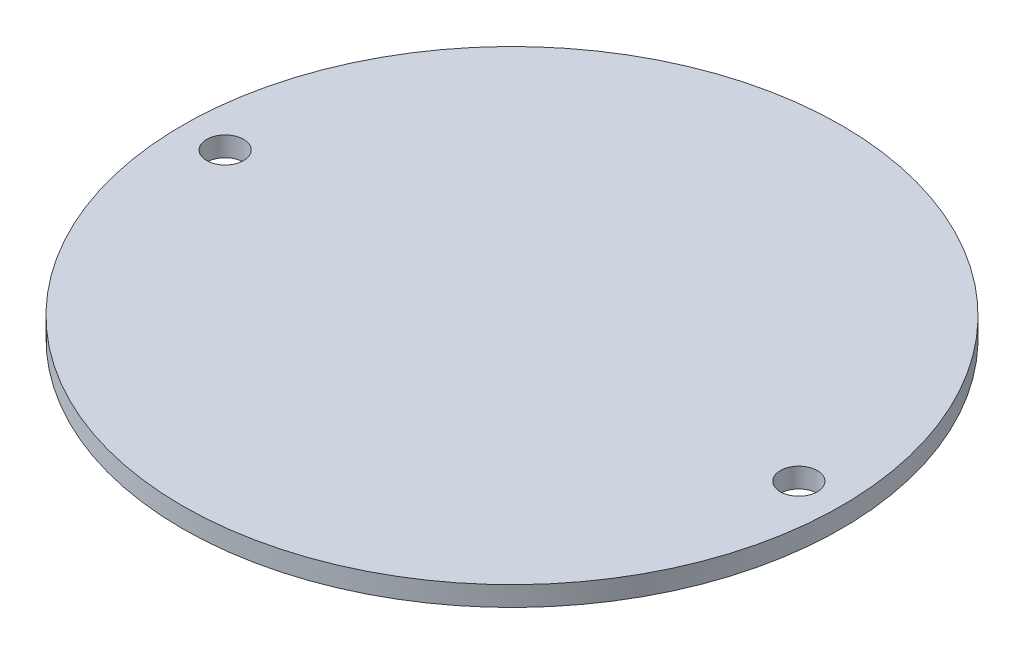
from build123d import *

# Parameters (mm, degrees)
SKETCH1_R            = 62.5
BOSS_EXTRUDE1_DEPTH  = 3.75
M6_CLEARANCE_HOLE1_D = 7
CIRPATTERN1_COUNT    = 2


with BuildPart() as part:
    # Sketch1 → Boss-Extrude1 (new body)
    with BuildSketch(Plane(origin=(0, 0, 0), x_dir=(1, 0, 0), z_dir=(0, 1, 0))):
        with Locations(Location((0, 0, 0), (0, 0, 270))):
            Circle(SKETCH1_R)
    extrude(amount=BOSS_EXTRUDE1_DEPTH)

    # M6 Clearance Hole1 (through all)
    with Locations(Plane(origin=(0, 3.75, 0), x_dir=(1, 0, 0), z_dir=(0, 1, 0))):
        with Locations((-54.4, 0)):
            m6_clearance_hole1 = Hole(M6_CLEARANCE_HOLE1_D / 2)

    # CirPattern1: M6 Clearance Hole1 ×2 about axis
    cirpattern1_axis = Axis((0, 0, 0), (0, 1, 0))
    for i in range(1, CIRPATTERN1_COUNT):
        add(m6_clearance_hole1.rotate(cirpattern1_axis, i * 360 / CIRPATTERN1_COUNT), mode=Mode.SUBTRACT)


solid = part.part
